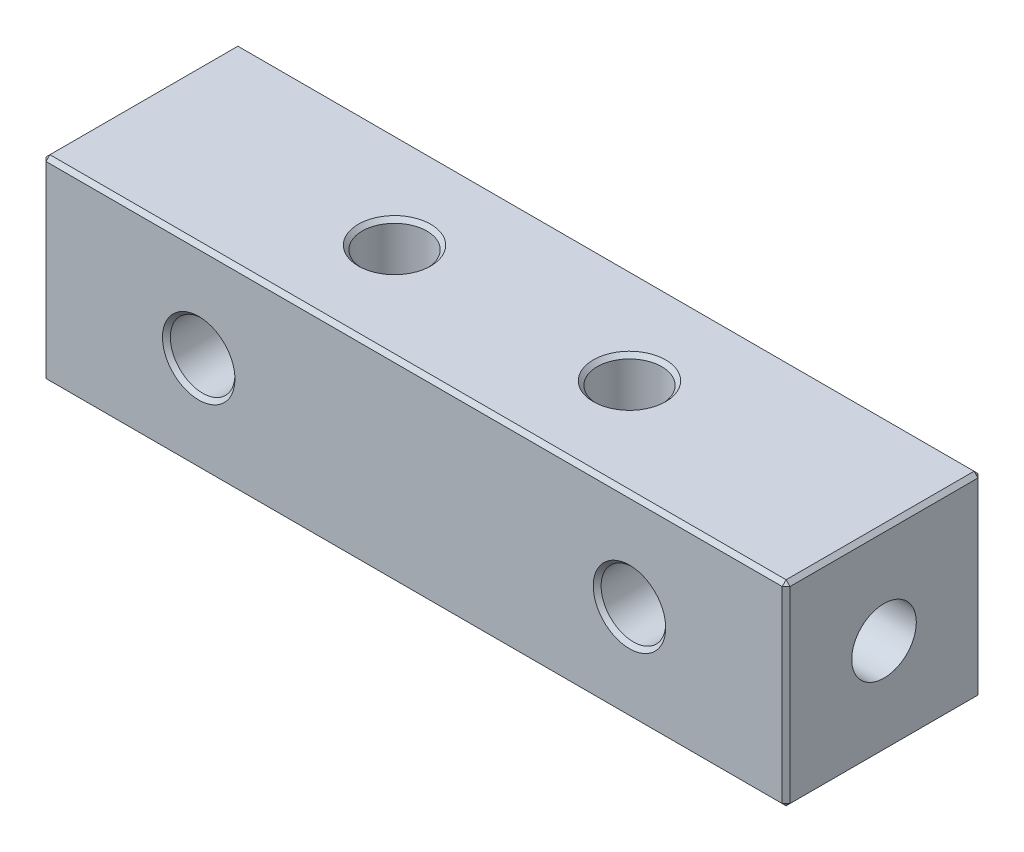
from build123d import *

# Parameters (mm, degrees)
SKETCH_1_W              = 38
SKETCH_1_H              = 10
EXTRUDE_1_DEPTH         = 5
HOLE_WIZARD_M4_1_D      = 3.3
HOLE_WIZARD_M4_2_D      = 3.3
CHAMFER_1_SIZE          = 0.2
HOLE_WIZARD_M4_3_REACH  = 40.652
HOLE_WIZARD_M4_3_BORE_R = 1.65
HOLE_WIZARD_M4_4_REACH  = 40.652
HOLE_WIZARD_M4_4_BORE_R = 1.65


with BuildPart() as part:
    # 草图1 → 凸台-拉伸1 (new, symmetric)
    with BuildSketch(Plane(origin=(0, 0, 0), x_dir=(1, 0, 0), z_dir=(0, 1, 0))):
        Rectangle(SKETCH_1_W, SKETCH_1_H)
    extrude(amount=EXTRUDE_1_DEPTH, both=True)

    # M4 螺纹孔1 (through all)
    with Locations(Plane(origin=(0, 5, 0), x_dir=(1, 0, 0), z_dir=(0, 1, 0))):
        with Locations((-6, 0), (6, 0)):
            Hole(HOLE_WIZARD_M4_1_D / 2)

    # M4 螺纹孔2 (through all)
    with Locations(Plane(origin=(0, 0, -5), x_dir=(-1, 0, 0), z_dir=(0, 0, -1))):
        with Locations((-11, 0), (11, 0)):
            Hole(HOLE_WIZARD_M4_2_D / 2)

    # 倒角1
    chamfer_1_edges = [part.edges().sort_by_distance(p)[0] for p in [
        (-19, 5, 0),
        (7.65, 5, 0),
        (7.65, -5, 0),
        (0, 5, 5),
        (-4.35, 5, 0),
        (-4.35, -5, 0),
        (-12.65, 0, -5),
        (-12.65, 0, 5),
        (9.35, 0, -5),
        (9.35, 0, 5),
        (19, 5, 0),
        (0, -5, 5),
        (-19, -5, 0),
        (0, -5, -5),
        (19, -5, 0),
        (19, 0, 5),
        (-19, 0, 5),
        (-19, 0, -5),
        (19, 0, -5),
        (0, 5, -5),
    ]]
    chamfer(chamfer_1_edges, length=CHAMFER_1_SIZE)

    # M4 螺纹孔3 bore → M4 螺纹孔3 (cut, up to next)
    with BuildSketch(Plane.ZY.offset(19), mode=Mode.PRIVATE) as hole_wizard_m4_3_sk1:
        Circle(HOLE_WIZARD_M4_3_BORE_R)
    hole_wizard_m4_3_tool1 = extrude(hole_wizard_m4_3_sk1.sketch, amount=-HOLE_WIZARD_M4_3_REACH, mode=Mode.PRIVATE) & part.part
    add(hole_wizard_m4_3_tool1.solids().sort_by_distance((-19, 0, 0))[0], mode=Mode.SUBTRACT)

    # M4 螺纹孔4 bore → M4 螺纹孔4 (cut, up to next)
    with BuildSketch(Plane(origin=(19, 0, 0), x_dir=(0, 0, -1), z_dir=(1, 0, 0)), mode=Mode.PRIVATE) as hole_wizard_m4_4_sk1:
        Circle(HOLE_WIZARD_M4_4_BORE_R)
    hole_wizard_m4_4_tool1 = extrude(hole_wizard_m4_4_sk1.sketch, amount=-HOLE_WIZARD_M4_4_REACH, mode=Mode.PRIVATE) & part.part
    add(hole_wizard_m4_4_tool1.solids().sort_by_distance((19, 0, 0))[0], mode=Mode.SUBTRACT)


solid = part.part
